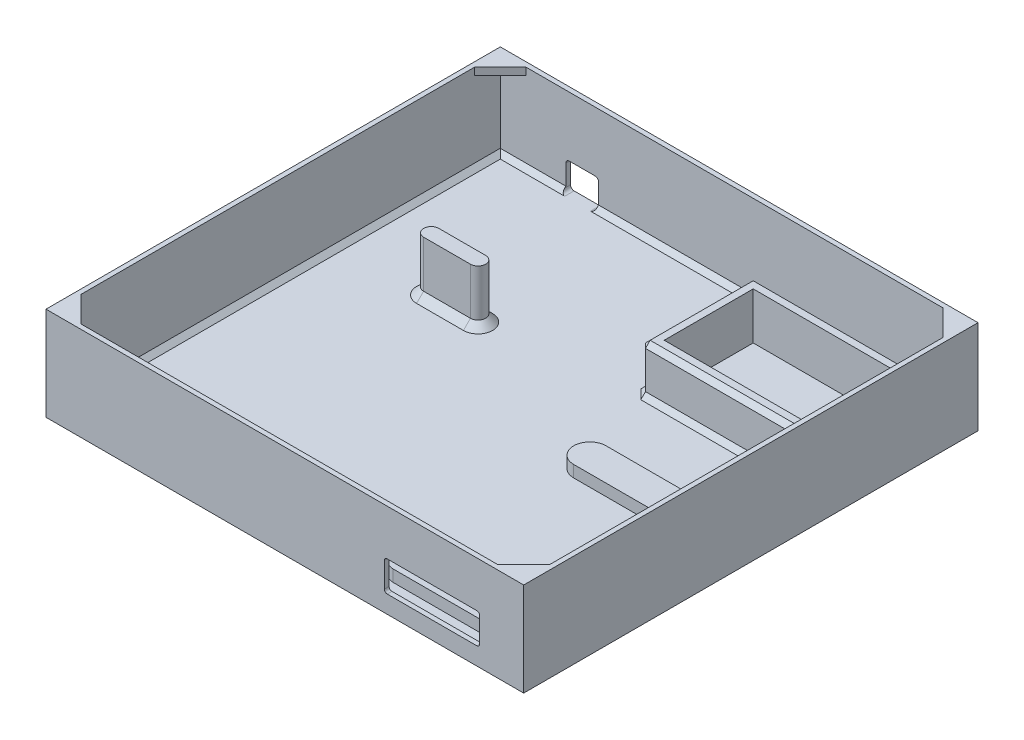
from build123d import *

# Parameters (mm, degrees)
IZIM1_W                     = 204
IZIM1_H                     = 194
Y_KSEKLIK_EKSTR_ZYON2_DEPTH = 40
IZIM3_W                     = 200
IZIM3_H                     = 190
KES_EKSTR_ZYON2_DEPTH       = 37.5
Y_KSEKLIK_EKSTR_ZYON3_DEPTH = 23
IZIM6_W                     = 70
IZIM6_H                     = 48
IZIM6_W_2                   = 60
IZIM6_H_2                   = 38
Y_KSEKLIK_EKSTR_ZYON4_DEPTH = 20
Y_KSEKLIK_EKSTR_ZYON7_DEPTH = 5
Y_KSEKLIK_EKSTR_ZYON8_DEPTH = 3
KES_EKSTR_ZYON5_DEPTH       = 3
KES_EKSTR_ZYON7_DEPTH       = 3
PAH1_SIZE                   = 2
PAH2_SIZE                   = 3


with BuildPart() as part:
    # Çizim1 → Yükseklik-Ekstrüzyon2 (new body)
    with BuildSketch(Plane(origin=(0, 0, 0), x_dir=(1, 0, 0), z_dir=(0, 1, 0))):
        Rectangle(IZIM1_W, IZIM1_H)
    extrude(amount=Y_KSEKLIK_EKSTR_ZYON2_DEPTH)

    # Çizim3 → Kes-Ekstrüzyon2 (cut)
    with BuildSketch(Plane(origin=(0, 40, 0), x_dir=(1, 0, 0), z_dir=(0, 1, 0))):
        Rectangle(IZIM3_W, IZIM3_H)
    extrude(amount=-KES_EKSTR_ZYON2_DEPTH, mode=Mode.SUBTRACT)

    # Çizim4 → Yükseklik-Ekstrüzyon3 (add)
    with BuildSketch(Plane(origin=(0, 2.5, 0), x_dir=(1, 0, 0), z_dir=(0, 1, 0))):
        with BuildLine():
            Line((-62.5, 24.75), (-42.5, 24.75))
            ThreePointArc((-42.5, 24.75), (-39.25, 28), (-42.5, 31.25))
            Line((-42.5, 31.25), (-62.5, 31.25))
            ThreePointArc((-62.5, 31.25), (-65.75, 28), (-62.5, 24.75))
        make_face()
        with BuildLine():
            Line((-62.5, -87.25), (-42.5, -87.25))
            ThreePointArc((-42.5, -87.25), (-39.25, -84), (-42.5, -80.75))
            Line((-42.5, -80.75), (-62.5, -80.75))
            ThreePointArc((-62.5, -80.75), (-65.75, -84), (-62.5, -87.25))
        make_face()
    extrude(amount=Y_KSEKLIK_EKSTR_ZYON3_DEPTH)

    # Çizim6 → Yükseklik-Ekstrüzyon4 (add)
    with BuildSketch(Plane(origin=(0, 2.5, 0), x_dir=(1, 0, 0), z_dir=(0, 1, 0))):
        with Locations((54, 60)):
            Rectangle(IZIM6_W, IZIM6_H)
        with Locations((54, 60)):
            Rectangle(IZIM6_W_2, IZIM6_H_2, mode=Mode.SUBTRACT)
    extrude(amount=Y_KSEKLIK_EKSTR_ZYON4_DEPTH)

    # Çizim7 → Yükseklik-Ekstrüzyon7 (add)
    with BuildSketch(Plane(origin=(0, 2.5, 0), x_dir=(1, 0, 0), z_dir=(0, 1, 0))):
        with BuildLine():
            Line((35.6, -9.25), (84.4, -9.25))
            ThreePointArc((84.4, -9.25), (91.3, -2.35), (84.4, 4.55))
            Line((84.4, 4.55), (35.6, 4.55))
            ThreePointArc((35.6, 4.55), (28.7, -2.35), (35.6, -9.25))
        make_face()
        with BuildLine():
            Line((35.6, -77.25), (84.4, -77.25))
            ThreePointArc((84.4, -77.25), (88.64386759, -81.85), (84.4, -86.45))
            Line((84.4, -86.45), (35.6, -86.45))
            ThreePointArc((35.6, -86.45), (31, -81.85), (35.6, -77.25))
        make_face()
    extrude(amount=Y_KSEKLIK_EKSTR_ZYON7_DEPTH)

    # Çizim8 → Yükseklik-Ekstrüzyon8 (add)
    with BuildSketch(Plane(origin=(0, 40, 0), x_dir=(1, 0, 0), z_dir=(0, 1, 0))):
        Polygon((-102, 97), (-102, 82), (-87, 97), align=None)
        Polygon((102, 97), (87, 97), (102, 82), align=None)
        Polygon((102, -97), (102, -82), (87, -97), align=None)
        Polygon((-102, -97), (-87, -97), (-102, -82), align=None)
    extrude(amount=-Y_KSEKLIK_EKSTR_ZYON8_DEPTH)

    # Çizim9 → Kes-Ekstrüzyon5 (cut)
    with BuildSketch(Plane.XY.offset(97)):
        with BuildLine():
            Line((43.7, 7.5), (82, 7.5))
            ThreePointArc((82, 7.5), (82.848528137, 7.851471863), (83.2, 8.7))
            Line((83.2, 8.7), (83.2, 19.3))
            ThreePointArc((83.2, 19.3), (82.848528137, 20.148528137), (82, 20.5))
            Line((82, 20.5), (43.7, 20.5))
            ThreePointArc((43.7, 20.5), (42.851471863, 20.148528137), (42.5, 19.3))
            Line((42.5, 19.3), (42.5, 8.7))
            ThreePointArc((42.5, 8.7), (42.851471863, 7.851471863), (43.7, 7.5))
        make_face()
    extrude(amount=-KES_EKSTR_ZYON5_DEPTH, mode=Mode.SUBTRACT)

    # Çizim11 → Kes-Ekstrüzyon7 (cut)
    with BuildSketch(Plane(origin=(0, 0, -97), x_dir=(-1, 0, 0), z_dir=(0, 0, -1))):
        with BuildLine():
            Line((59.5, 2.5), (70.5, 2.5))
            ThreePointArc((70.5, 2.5), (71.560660172, 2.939339828), (72, 4))
            Line((72, 4), (72, 13))
            ThreePointArc((72, 13), (71.560660172, 14.060660172), (70.5, 14.5))
            Line((70.5, 14.5), (59.5, 14.5))
            ThreePointArc((59.5, 14.5), (58.439339828, 14.060660172), (58, 13))
            Line((58, 13), (58, 4))
            ThreePointArc((58, 4), (58.439339828, 2.939339828), (59.5, 2.5))
        make_face()
    extrude(amount=-KES_EKSTR_ZYON7_DEPTH, mode=Mode.SUBTRACT)

    # Pah1
    pah1_edges = [part.edges().sort_by_distance(p)[0] for p in [
        (0, 2.5, 95),
        (-100, 2.5, 0),
        (-85.25, 2.5, -95),
        (100, 2.5, 0),
        (20.25, 2.5, -95),
        (89, 22.5, -60),
        (54, 22.5, -84),
        (19, 22.5, -60),
        (54, 22.5, -36),
        (89, 2.5, -60),
        (89, 12.5, -36),
        (54, 2.5, -84),
        (89, 12.5, -84),
        (19, 2.5, -60),
        (19, 12.5, -84),
        (54, 2.5, -36),
        (19, 12.5, -36),
    ]]
    chamfer(pah1_edges, length=PAH1_SIZE)

    # Pah2
    pah2_edges = [part.edges().sort_by_distance(p)[0] for p in [
        (-39.25, 2.5, 84),
        (-52.5, 2.5, 80.75),
        (-65.75, 2.5, 84),
        (-52.5, 2.5, 87.25),
        (-65.75, 2.5, -28),
        (-52.5, 2.5, -24.75),
        (-39.25, 2.5, -28),
        (-52.5, 2.5, -31.25),
    ]]
    chamfer(pah2_edges, length=PAH2_SIZE)


solid = part.part
